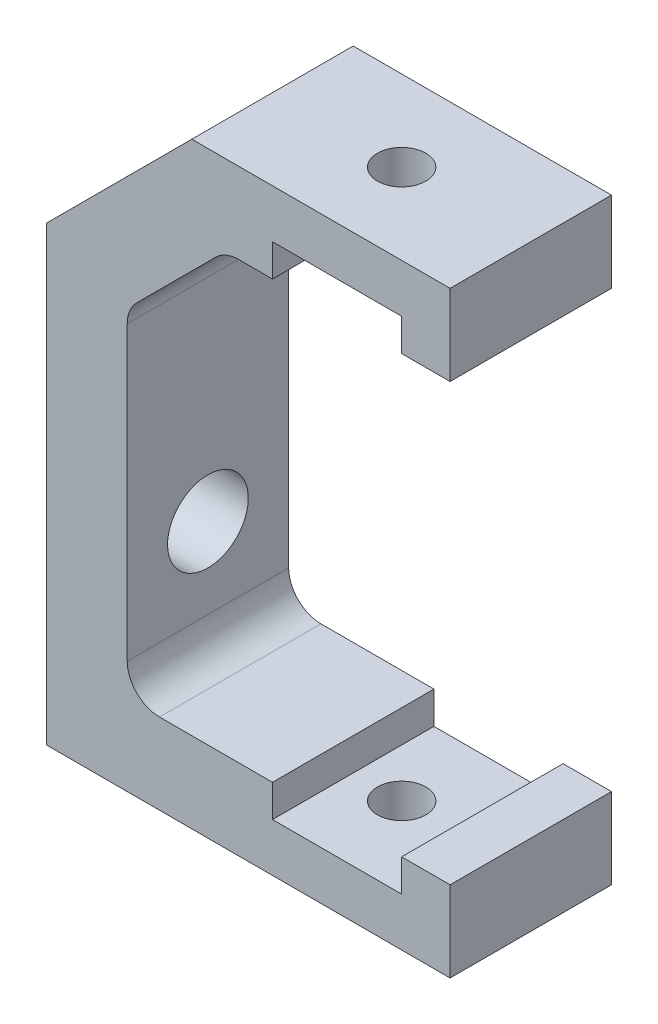
from build123d import *

# Parameters (mm, degrees)
BOSS_EXTRUDE1_DEPTH = 5
CUT_EXTRUDE1_REACH  = 46.933
SKETCH2_R           = 1.5
SKETCH3_R           = 2.5
CUT_EXTRUDE2_DEPTH  = 5


with BuildPart() as part:
    # Sketch1 → Boss-Extrude1 (new, symmetric)
    with BuildSketch(Plane.XY):
        with BuildLine():
            Line((0, 0), (0, 28))
            Line((0, 28), (9, 37))
            Line((9, 37), (25, 37))
            Line((25, 37), (25, 32))
            Line((25, 32), (22, 32))
            Line((22, 32), (22, 34))
            Line((22, 34), (14, 34))
            Line((14, 34), (14, 32))
            Line((14, 32), (11.899494937, 32))
            ThreePointArc((11.899494937, 32), (11.134128072, 31.847759065), (10.485281374, 31.414213562))
            Line((10.485281374, 31.414213562), (5.585786438, 26.514718626))
            ThreePointArc((5.585786438, 26.514718626), (5.152240935, 25.865871928), (5, 25.100505063))
            Line((5, 25.100505063), (5, 7))
            ThreePointArc((5, 7), (5.585786438, 5.585786438), (7, 5))
            Line((7, 5), (14, 5))
            Line((14, 5), (14, 3))
            Line((14, 3), (22, 3))
            Line((22, 3), (22, 5))
            Line((22, 5), (25, 5))
            Line((25, 5), (25, 0))
            Line((25, 0), (0, 0))
        make_face()
    extrude(amount=BOSS_EXTRUDE1_DEPTH, both=True)

    # Cut-Extrude1: up to this face of the body (flat: up to its plane)
    cut_extrude1_end = Plane(part.part.faces().sort_by_distance((12.5, 0, 0))[0])
    # Sketch2 → Cut-Extrude1 (cut, up to the picked face)
    with BuildSketch(Plane(origin=(0, 37, 0), x_dir=(1, 0, 0), z_dir=(0, 1, 0)), mode=Mode.PRIVATE) as cut_extrude1_sk1:
        with Locations(Location((17, 0, 0), (0, 0, 180))):
            Circle(SKETCH2_R)
    cut_extrude1_tool1 = split(extrude(cut_extrude1_sk1.sketch, amount=-CUT_EXTRUDE1_REACH, mode=Mode.PRIVATE), bisect_by=cut_extrude1_end, keep=Keep.BOTH, mode=Mode.PRIVATE)
    add(cut_extrude1_tool1.solids().sort_by(Axis((17, 37, 0), (0, -1, 0)))[0], mode=Mode.SUBTRACT)

    # Sketch3 → Cut-Extrude2 (cut)
    with BuildSketch(Plane(origin=(5, 0, 0), x_dir=(0, 0, -1), z_dir=(1, 0, 0))):
        with Locations(Location((0, 12, 0), (0, 0, 90))):
            Circle(SKETCH3_R)
    extrude(amount=-CUT_EXTRUDE2_DEPTH, mode=Mode.SUBTRACT)


solid = part.part
